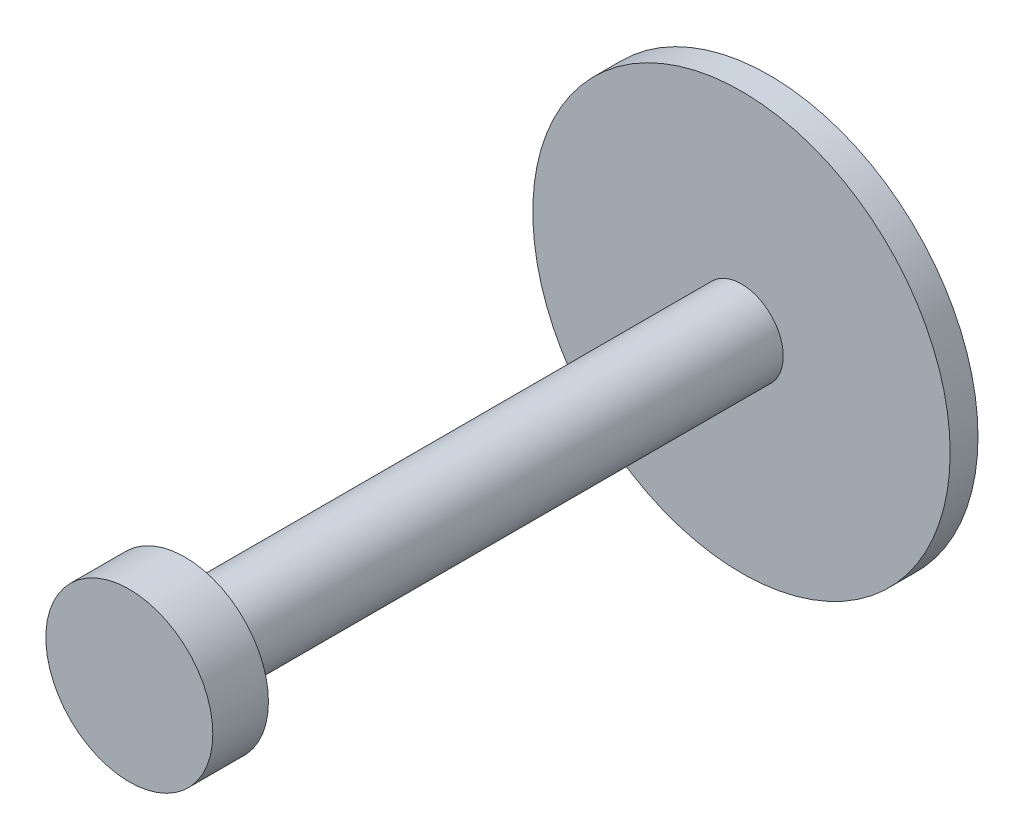
from build123d import *

# Parameters (mm, degrees)
SKETCH1_R           = 75
BOSS_EXTRUDE1_DEPTH = 10
SKETCH2_R           = 15
BOSS_EXTRUDE2_DEPTH = 200
SKETCH3_R           = 30
BOSS_EXTRUDE3_DEPTH = 20


with BuildPart() as part:
    # Sketch1 → Boss-Extrude1 (new body)
    with BuildSketch(Plane.XY):
        Circle(SKETCH1_R)
    extrude(amount=BOSS_EXTRUDE1_DEPTH)

    # Sketch2 → Boss-Extrude2 (add)
    with BuildSketch(Plane.XY.offset(10)):
        Circle(SKETCH2_R)
    extrude(amount=BOSS_EXTRUDE2_DEPTH)

    # Sketch3 → Boss-Extrude3 (add)
    with BuildSketch(Plane.XY.offset(210)):
        Circle(SKETCH3_R)
    extrude(amount=BOSS_EXTRUDE3_DEPTH)


solid = part.part
